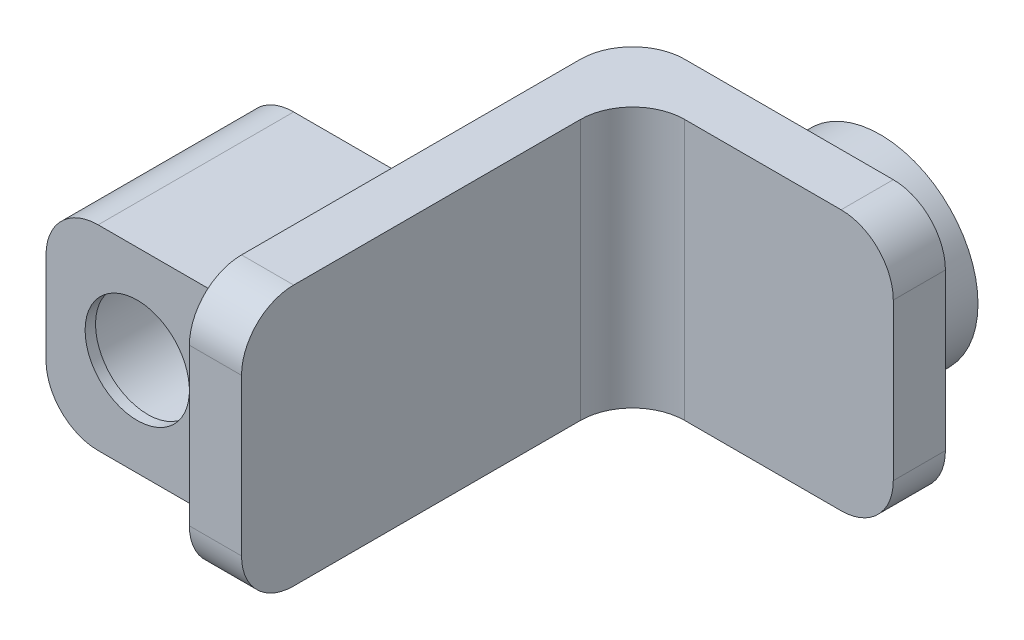
from build123d import *
from OCP.BRepFilletAPI import BRepFilletAPI_MakeFillet

# Parameters (mm, degrees)
SCHIZZO1_R                     = 37.5
FISSAGGIOMANDRINO_DEPTH        = 25
SCHIZZO2_W                     = 120
SCHIZZO2_H                     = 100
PIASTRA_DEPTH                  = 20
SCHIZZO3_R                     = 3.125
ACCOPPIAMENTOMANDRINI_DEPTH    = 7
SCHIZZO4_W                     = 20
SCHIZZO4_H                     = 100
BASEADATTATORE_DEPTH           = 150
RACCORDO1_R                    = 20
SCHIZZO5_W                     = 70
SCHIZZO5_H                     = 75
BASETORCIA_DEPTH               = 37.5
SCHIZZO6_R                     = 25
FOROTORICA_DEPTH               = 183.002747232
SCHIZZO7_R                     = 25
SCHIZZO7_R_2                   = 22.5
CONTATTOPOSTERIORETORCIA_DEPTH = 5
SCHIZZO8_R                     = 25
SCHIZZO8_R_2                   = 23
PRIMOCONTATTOANTERIORE_DEPTH   = 2
SCHIZZO9_R                     = 25
SCHIZZO9_R_2                   = 20
SECONDOCONTATTOANTERIORE_DEPTH = 4
RACCORDO2_R1                   = 20
RACCORDO2_R2                   = 6


with BuildPart() as part:
    # Schizzo1 → FissaggioMandrino (new body)
    with BuildSketch(Plane.XY):
        Circle(SCHIZZO1_R)
    extrude(amount=-FISSAGGIOMANDRINO_DEPTH)

    # Schizzo2 → Piastra (add)
    with BuildSketch(Plane.XY):
        with Locations((-10, 0)):
            Rectangle(SCHIZZO2_W, SCHIZZO2_H)
    extrude(amount=PIASTRA_DEPTH)

    # Schizzo3 → AccoppiamentoMandrini (cut)
    with BuildSketch(Plane(origin=(0, 0, -25), x_dir=(-1, 0, 0), z_dir=(0, 0, -1))):
        with Locations((29.375, 0)):
            Circle(SCHIZZO3_R)
        with Locations((27.138961268, -11.241325826)):
            Circle(SCHIZZO3_R)
        with Locations((20.771261697, -20.771261697)):
            Circle(SCHIZZO3_R)
        with Locations((11.241325826, -27.138961268)):
            Circle(SCHIZZO3_R)
        with Locations((0, -29.375)):
            Circle(SCHIZZO3_R)
        with Locations((-11.241325826, -27.138961268)):
            Circle(SCHIZZO3_R)
        with Locations((-20.771261697, -20.771261697)):
            Circle(SCHIZZO3_R)
        with Locations((-27.138961268, -11.241325826)):
            Circle(SCHIZZO3_R)
        with Locations((-29.375, 0)):
            Circle(SCHIZZO3_R)
        with Locations((-27.138961268, 11.241325826)):
            Circle(SCHIZZO3_R)
        with Locations((-20.771261697, 20.771261697)):
            Circle(SCHIZZO3_R)
        with Locations((-11.241325826, 27.138961268)):
            Circle(SCHIZZO3_R)
        with Locations((0, 29.375)):
            Circle(SCHIZZO3_R)
        with Locations((11.241325826, 27.138961268)):
            Circle(SCHIZZO3_R)
        with Locations((20.771261697, 20.771261697)):
            Circle(SCHIZZO3_R)
        with Locations((27.138961268, 11.241325826)):
            Circle(SCHIZZO3_R)
    extrude(amount=-ACCOPPIAMENTOMANDRINI_DEPTH, mode=Mode.SUBTRACT)

    # Schizzo4 → BaseAdattatore (add)
    with BuildSketch(Plane.XY.offset(20)):
        with Locations((-60, 0)):
            Rectangle(SCHIZZO4_W, SCHIZZO4_H)
    extrude(amount=BASEADATTATORE_DEPTH)

    # Raccordo1
    raccordo1_edges = [part.edges().sort_by_distance(p)[0] for p in [
        (-70, 0, 0),
        (50, -50, 10),
        (50, 50, 10),
        (-50, 0, 20),
        (-60, -50, 170),
        (-60, 50, 170),
    ]]
    fillet(raccordo1_edges, radius=RACCORDO1_R)

    # Schizzo5 → BaseTorcia (add, symmetric)
    with BuildSketch(Plane(origin=(0, 0, 0), x_dir=(1, 0, 0), z_dir=(0, 1, 0))):
        with Locations((-105, -117.5)):
            Rectangle(SCHIZZO5_W, SCHIZZO5_H)
    extrude(amount=BASETORCIA_DEPTH, both=True)

    # Schizzo6 → ForoTorica (cut, through all)
    with BuildSketch(Plane(origin=(0, 0, 80), x_dir=(-1, 0, 0), z_dir=(0, 0, -1))):
        with Locations((105, 0)):
            Circle(SCHIZZO6_R)
    extrude(amount=-FOROTORICA_DEPTH, mode=Mode.SUBTRACT)

    # Schizzo7 → ContattoPosterioreTorcia (add)
    with BuildSketch(Plane(origin=(0, 0, 80), x_dir=(-1, 0, 0), z_dir=(0, 0, -1))):
        with Locations((105, 0)):
            Circle(SCHIZZO7_R)
        with Locations((105, 0)):
            Circle(SCHIZZO7_R_2, mode=Mode.SUBTRACT)
    extrude(amount=-CONTATTOPOSTERIORETORCIA_DEPTH)

    # Schizzo8 → PrimoContattoAnteriore (add)
    with BuildSketch(Plane.XY.offset(149)):
        with Locations(Location((-105, 0, 0), (0, 0, 180))):
            Circle(SCHIZZO8_R)
        with Locations((-105, 0)):
            Circle(SCHIZZO8_R_2, mode=Mode.SUBTRACT)
    extrude(amount=PRIMOCONTATTOANTERIORE_DEPTH)

    # Schizzo9 → SecondocontattoAnteriore (add)
    with BuildSketch(Plane.XY.offset(151)):
        with Locations(Location((-105, 0, 0), (0, 0, 180))):
            Circle(SCHIZZO9_R)
        with Locations(Location((-105, 0, 0), (0, 0, 180))):
            Circle(SCHIZZO9_R_2, mode=Mode.SUBTRACT)
    extrude(amount=SECONDOCONTATTOANTERIORE_DEPTH)

    # Raccordo2: one fillet with a radius per group of edges: ONE call of the kernel's fillet builder (fillet() takes one radius for all edges)
    raccordo2_edges_1 = [part.edges().sort_by_distance(p)[0] for p in [
        (-140, -37.5, 117.5),
        (-140, 37.5, 117.5),
    ]]
    raccordo2_edges_2 = [part.edges().sort_by_distance(p)[0] for p in [
        (-70, 37.5, 117.5),
        (-70, -37.5, 117.5),
        (-70, 0, 80),
        (-70, 0, 155),
    ]]
    raccordo2 = BRepFilletAPI_MakeFillet(part.part.solid().wrapped)
    for e in raccordo2_edges_1:
        raccordo2.Add(RACCORDO2_R1, e.wrapped)
    for e in raccordo2_edges_2:
        raccordo2.Add(RACCORDO2_R2, e.wrapped)
    add(Compound.cast(raccordo2.Shape()), mode=Mode.REPLACE)


solid = part.part
